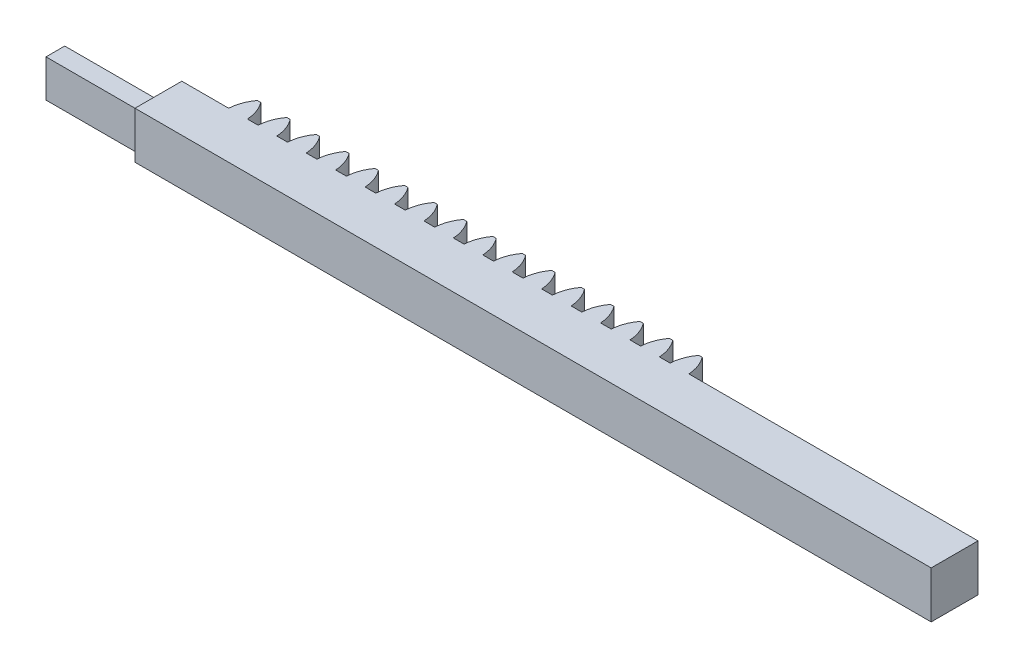
from build123d import *

# Parameters (mm, degrees)
BOSS_EXTRUDE1_DEPTH = 5
BOSS_EXTRUDE2_DEPTH = 5
LPATTERN1_COUNT     = 16
LPATTERN1_PITCH     = 3.142
SKETCH3_W           = 2
SKETCH3_H           = 4
BOSS_EXTRUDE3_DEPTH = 10


with BuildPart() as part:
    # Sketch2 → Boss-Extrude1 (new body)
    with BuildSketch(Plane(origin=(0, 0, 0), x_dir=(1, 0, 0), z_dir=(0, 1, 0))):
        Polygon((-32.752808989, 5), (-32.752808989, 0), (52.247191011, 0), (52.247191011, 5), (-25.752808989, 5), (-27.752808989, 5), align=None)
    extrude(amount=BOSS_EXTRUDE1_DEPTH)

    # Sketch2<3> → Boss-Extrude2 (add)
    with BuildSketch(Plane(origin=(0, 0, 0), x_dir=(1, 0, 0), z_dir=(0, 1, 0))):
        with BuildLine():
            ThreePointArc((-26.933875962, 7.25), (-27.510500845, 6.185840671), (-27.752808989, 5))
            Line((-27.752808989, 5), (-25.752808989, 5))
            ThreePointArc((-25.752808989, 5), (-25.995117132, 6.185840671), (-26.571742016, 7.25))
            Line((-26.571742016, 7.25), (-26.933875962, 7.25))
        make_face()
    boss_extrude2 = extrude(amount=BOSS_EXTRUDE2_DEPTH)

    # LPattern1: Boss-Extrude2 ×16
    with Locations(*[(i * LPATTERN1_PITCH, 0, 0) for i in range(1, LPATTERN1_COUNT)]):
        add(boss_extrude2)

    # Sketch3 → Boss-Extrude3 (add)
    with BuildSketch(Plane.ZY.offset(32.752808989)):
        with Locations((-1.5, 2.5)):
            Rectangle(SKETCH3_W, SKETCH3_H)
    extrude(amount=BOSS_EXTRUDE3_DEPTH)


solid = part.part
